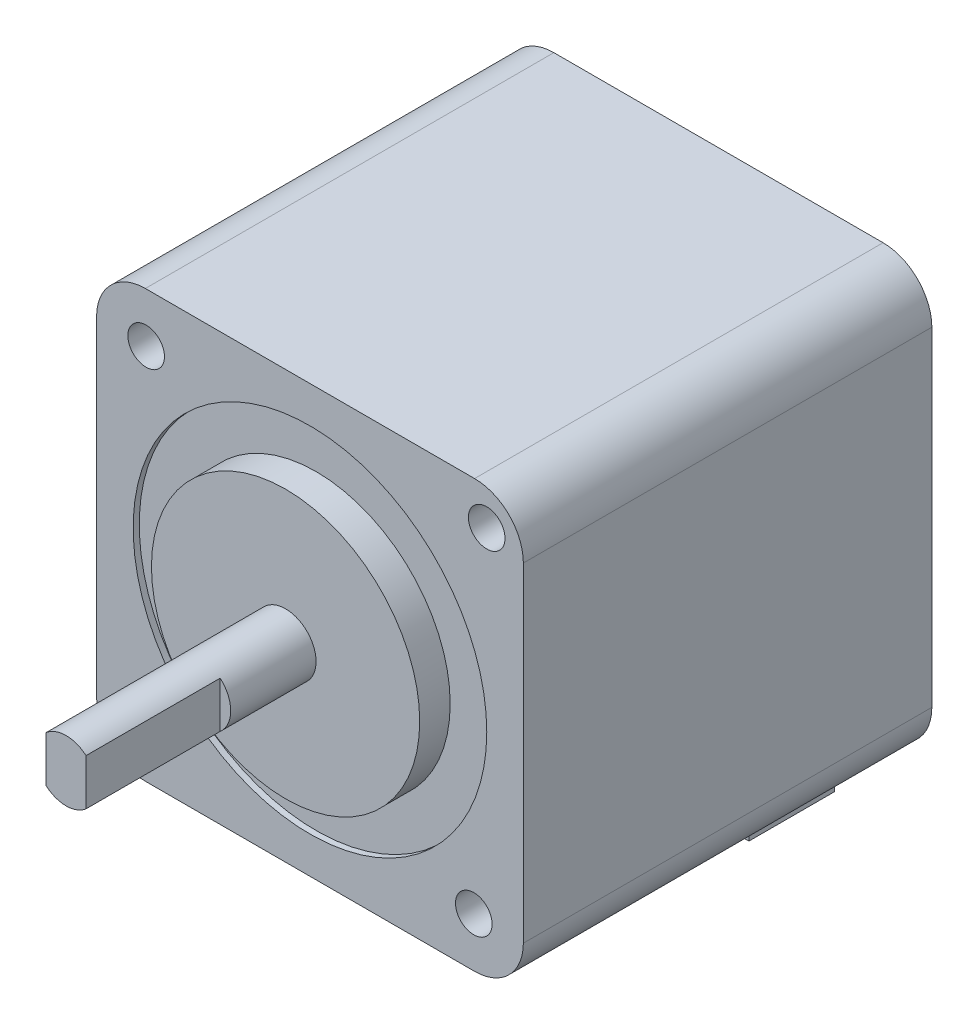
from build123d import *

# Parameters (mm, degrees)
SKETCH1_W           = 35
SKETCH1_H           = 35
BOSS_EXTRUDE1_DEPTH = 33.5
SKETCH2_R           = 11
BOSS_EXTRUDE2_DEPTH = 2
CUT_EXTRUDE1_START  = -0.5
SKETCH3_R           = 14.5
SKETCH3_R_2         = 11
CUT_EXTRUDE1_DEPTH  = 0.5
FILLET1_R           = 4
SKETCH4_R           = 1.5
CUT_EXTRUDE2_DEPTH  = 5
SKETCH5_R           = 2.5
BOSS_EXTRUDE3_DEPTH = 18
CUT_EXTRUDE3_START  = -11
CUT_EXTRUDE3_DEPTH  = 11
SKETCH7_W           = 21
SKETCH7_H           = 7
BOSS_EXTRUDE4_DEPTH = 5


with BuildPart() as part:
    # Sketch1 → Boss-Extrude1 (new body)
    with BuildSketch(Plane.XY):
        Rectangle(SKETCH1_W, SKETCH1_H)
    extrude(amount=BOSS_EXTRUDE1_DEPTH)

    # Sketch2 → Boss-Extrude2 (add)
    with BuildSketch(Plane.XY.offset(33.5)):
        Circle(SKETCH2_R)
    extrude(amount=BOSS_EXTRUDE2_DEPTH)

    # Sketch3 → Cut-Extrude1 (cut)
    with BuildSketch(Plane.XY.offset(33.5).offset(CUT_EXTRUDE1_START)):
        Circle(SKETCH3_R)
        Circle(SKETCH3_R_2, mode=Mode.SUBTRACT)
    extrude(amount=CUT_EXTRUDE1_DEPTH, mode=Mode.SUBTRACT)

    # Fillet1
    fillet1_edges = [part.edges().sort_by_distance(p)[0] for p in [
        (17.5, -17.5, 16.75),
        (-17.5, -17.5, 16.75),
        (-17.5, 17.5, 16.75),
        (17.5, 17.5, 16.75),
    ]]
    fillet(fillet1_edges, radius=FILLET1_R)

    # Sketch4 → Cut-Extrude2 (cut)
    with BuildSketch(Plane.XY.offset(33.5)):
        with Locations((14.495689014, 14.495689014)):
            Circle(SKETCH4_R)
        with Locations((-14.495689014, -14.495689014)):
            Circle(SKETCH4_R)
        with Locations((-13.435028843, 13.435028843)):
            Circle(SKETCH4_R)
        with Locations((13.435028843, -13.435028843)):
            Circle(SKETCH4_R)
    extrude(amount=-CUT_EXTRUDE2_DEPTH, mode=Mode.SUBTRACT)

    # Sketch5 → Boss-Extrude3 (add)
    with BuildSketch(Plane.XY.offset(35.5)):
        Circle(SKETCH5_R)
    extrude(amount=BOSS_EXTRUDE3_DEPTH)

    # Sketch6 → Cut-Extrude3 (cut)
    with BuildSketch(Plane.XY.offset(53.5).offset(CUT_EXTRUDE3_START)):
        with BuildLine():
            Line((1.63546218, 1.890836708), (1.63546218, -1.890836708))
            ThreePointArc((1.63546218, -1.890836708), (2.5, 0), (1.63546218, 1.890836708))
        make_face()
        with BuildLine():
            Line((-1.63546218, 1.890836708), (-1.63546218, -1.890836708))
            ThreePointArc((-1.63546218, -1.890836708), (-2.5, 0), (-1.63546218, 1.890836708))
        make_face()
    extrude(amount=CUT_EXTRUDE3_DEPTH, mode=Mode.SUBTRACT)

    # Sketch7 → Boss-Extrude4 (add)
    with BuildSketch(Plane.XZ.offset(17.5)):
        with Locations((0, 4.5)):
            Rectangle(SKETCH7_W, SKETCH7_H)
    extrude(amount=BOSS_EXTRUDE4_DEPTH)


solid = part.part
